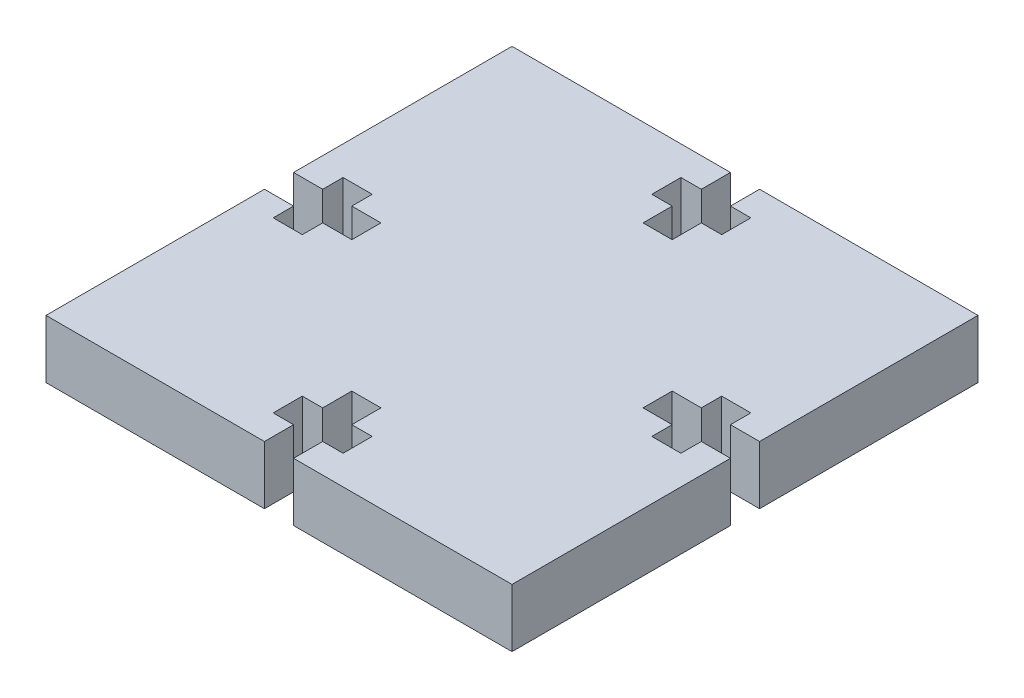
from build123d import *

# Parameters (mm, degrees)
SKETCH1_W           = 50.8
SKETCH1_H           = 50.8
BOSS_EXTRUDE1_DEPTH = 6.35
CUT_EXTRUDE6_DEPTH  = 73.122135992


with BuildPart() as part:
    # Sketch1 → Boss-Extrude1 (new body)
    with BuildSketch(Plane(origin=(0, 0, 0), x_dir=(1, 0, 0), z_dir=(0, 1, 0))):
        with Locations((25.4, 25.4)):
            Rectangle(SKETCH1_W, SKETCH1_H)
    extrude(amount=BOSS_EXTRUDE1_DEPTH)

    # Sketch2 → Cut-Extrude6 (cut, through all)
    with BuildSketch(Plane(origin=(0, 6.35, 0), x_dir=(1, 0, 0), z_dir=(0, 1, 0))):
        Polygon((21.59, 47.625), (23.8125, 47.625), (23.8125, 50.8), (26.9875, 50.8), (26.9875, 47.625), (29.21, 47.625), (29.21, 44.45), (26.9875, 44.45), (26.9875, 41.275), (23.8125, 41.275), (23.8125, 44.45), (21.59, 44.45), align=None)
        Polygon((26.9875, 6.35), (29.21, 6.35), (29.21, 3.175), (26.9875, 3.175), (26.9875, 0), (23.8125, 0), (23.8125, 3.175), (21.59, 3.175), (21.59, 6.35), (23.8125, 6.35), (23.8125, 9.525), (26.9875, 9.525), align=None)
        Polygon((3.175, 26.9875), (3.175, 29.21), (6.35, 29.21), (6.35, 26.9875), (9.525, 26.9875), (9.525, 23.8125), (6.35, 23.8125), (6.35, 21.59), (3.175, 21.59), (3.175, 23.8125), (0, 23.8125), (0, 26.9875), align=None)
        Polygon((47.625, 23.8125), (50.8, 23.8125), (50.8, 26.9875), (47.625, 26.9875), (47.625, 29.21), (44.45, 29.21), (44.45, 26.9875), (41.275, 26.9875), (41.275, 23.8125), (44.45, 23.8125), (44.45, 21.59), (47.625, 21.59), align=None)
    extrude(amount=-CUT_EXTRUDE6_DEPTH, mode=Mode.SUBTRACT)


solid = part.part
